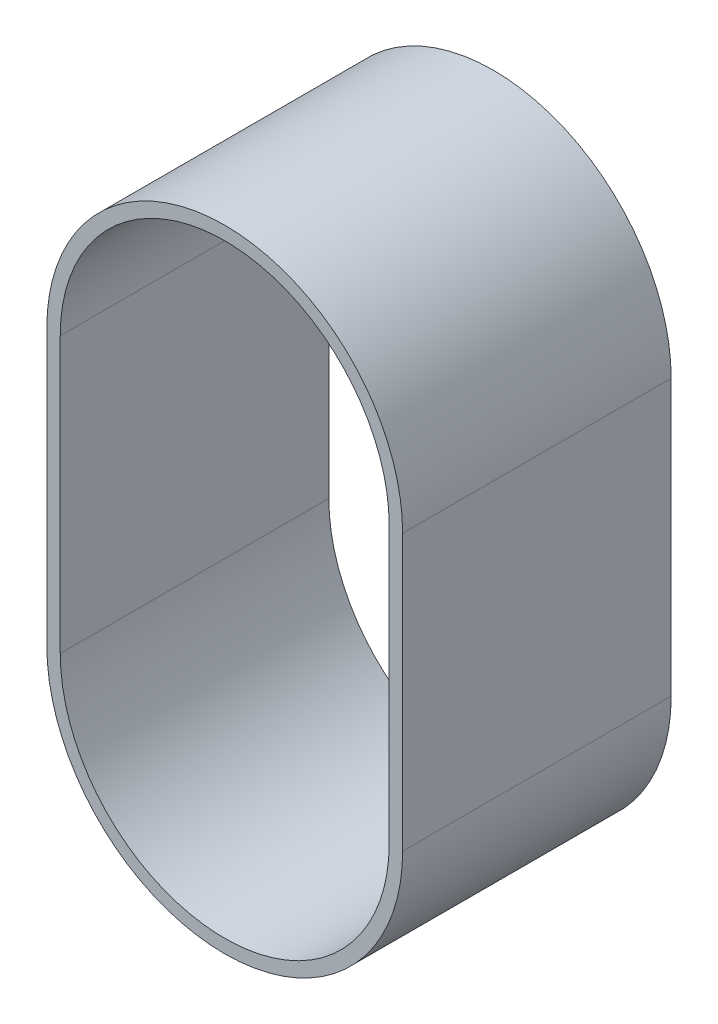
from build123d import *

# Parameters (mm, degrees)
BOSS_EXTRUDE1_DEPTH = 20


with BuildPart() as part:
    # Sketch1 → Boss-Extrude1 (new body)
    with BuildSketch(Plane.XY):
        with BuildLine():
            Line((10.363792049, -6.036739239), (10.363792049, -26.536739239))
            ThreePointArc((10.363792049, -26.536739239), (-2.886207951, -39.786739239), (-16.136207951, -26.536739239))
            Line((-16.136207951, -26.536739239), (-16.136207951, -6.036739239))
            ThreePointArc((-16.136207951, -6.036739239), (-2.886207951, 7.213260761), (10.363792049, -6.036739239))
        make_face()
        with BuildLine():
            Line((9.363792049, -6.036739239), (9.363792049, -26.536739239))
            ThreePointArc((9.363792049, -26.536739239), (-2.886207951, -38.786739239), (-15.136207951, -26.536739239))
            Line((-15.136207951, -26.536739239), (-15.136207951, -6.036739239))
            ThreePointArc((-15.136207951, -6.036739239), (-2.886207951, 6.213260761), (9.363792049, -6.036739239))
        make_face(mode=Mode.SUBTRACT)
    extrude(amount=BOSS_EXTRUDE1_DEPTH)


solid = part.part
